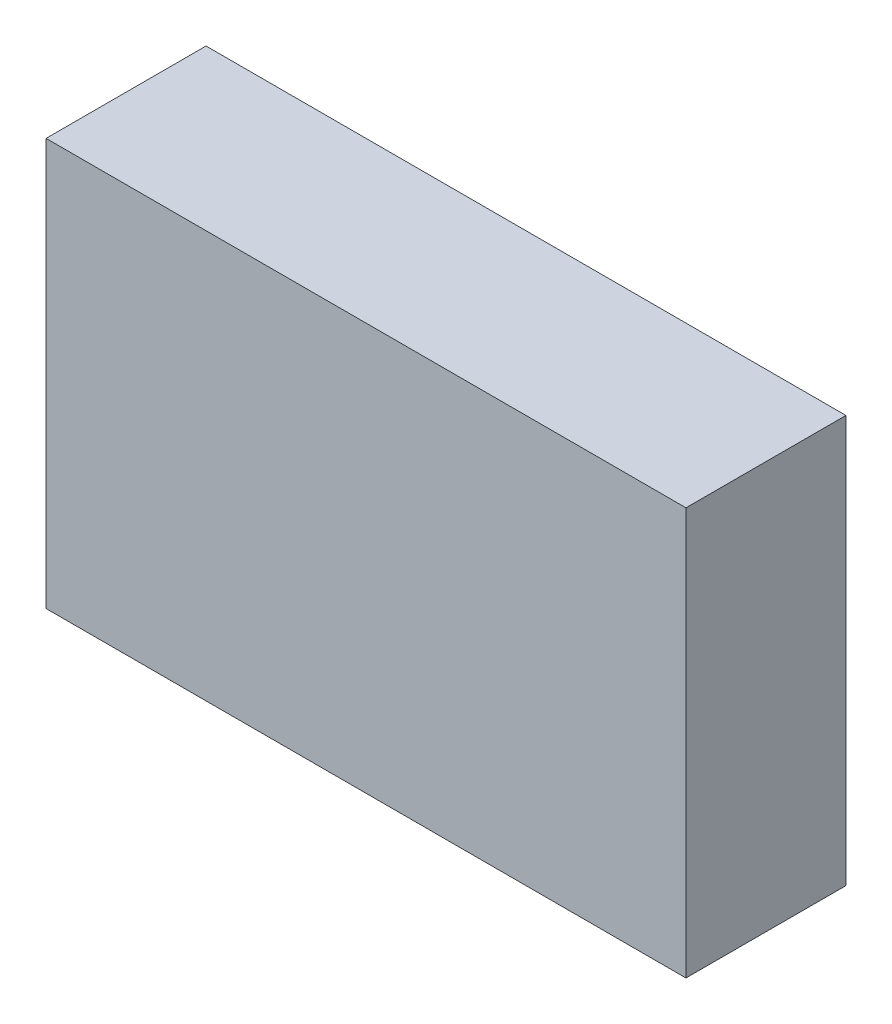
from build123d import *

# Parameters (mm, degrees)
COMPONENT_OUTLINE_DEPTH = 0.55


with BuildPart() as part:
    # 草图1 → Component_Outline (new body)
    with BuildSketch(Plane.XY):
        Polygon((-1.1, -0.7), (-1.1, -0.575), (-1.1, 0.575), (-1.1, 0.7), (1.1, 0.7), (1.1, -0.7), align=None)
    extrude(amount=COMPONENT_OUTLINE_DEPTH)


solid = part.part
